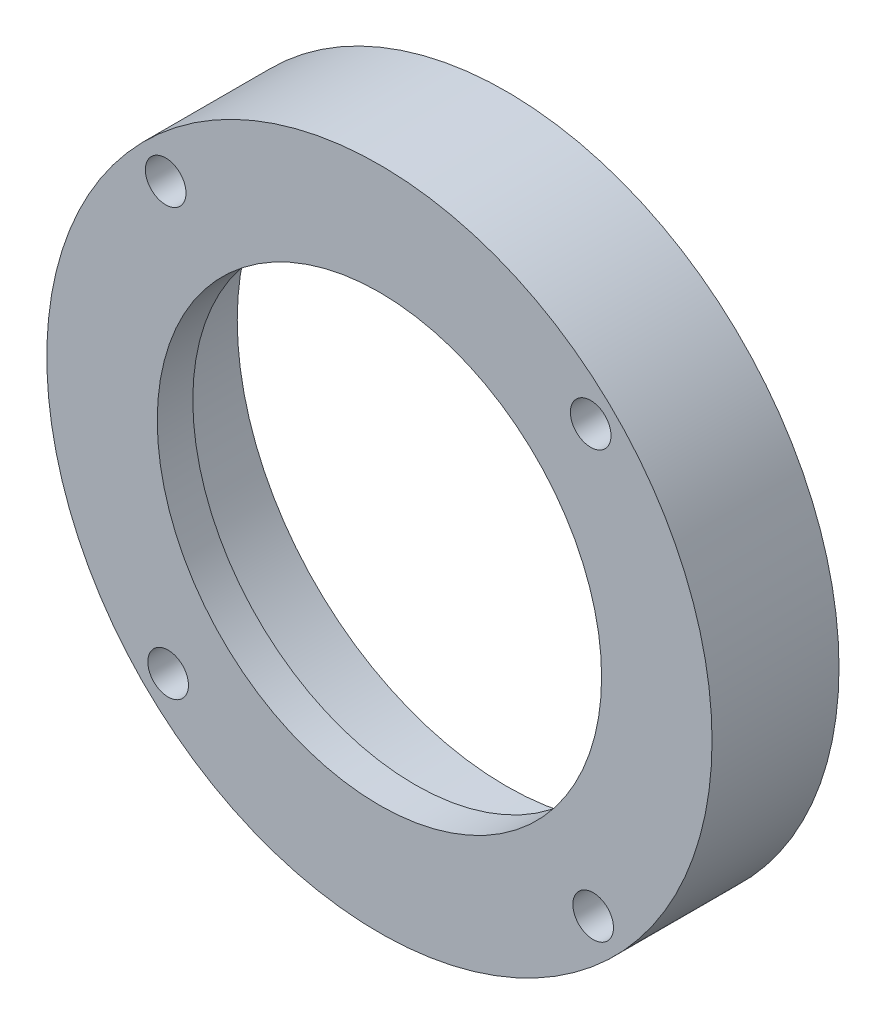
from build123d import *

# Parameters (mm, degrees)
SKETCH1_R           = 26.2
SKETCH1_R_2         = 1.6
SKETCH1_R_3         = 17.5
BOSS_EXTRUDE1_DEPTH = 10
SKETCH2_R           = 21.2
CUT_EXTRUDE1_DEPTH  = 7.2


with BuildPart() as part:
    # Sketch1 → Boss-Extrude1 (new body)
    with BuildSketch(Plane.XY):
        Circle(SKETCH1_R)
        with Locations((16.641288224, 16.83568778)):
            Circle(SKETCH1_R_2, mode=Mode.SUBTRACT)
        with Locations((16.835542861, -16.64174274)):
            Circle(SKETCH1_R_2, mode=Mode.SUBTRACT)
        with Locations((-16.641887659, -16.835997377)):
            Circle(SKETCH1_R_2, mode=Mode.SUBTRACT)
        with Locations((-16.836142296, 16.641433143)):
            Circle(SKETCH1_R_2, mode=Mode.SUBTRACT)
        Circle(SKETCH1_R_3, mode=Mode.SUBTRACT)
    extrude(amount=BOSS_EXTRUDE1_DEPTH)

    # Sketch2 → Cut-Extrude1 (cut)
    with BuildSketch(Plane(origin=(0, 0, 0), x_dir=(-1, 0, 0), z_dir=(0, 0, -1))):
        Circle(SKETCH2_R)
    extrude(amount=-CUT_EXTRUDE1_DEPTH, mode=Mode.SUBTRACT)


solid = part.part
